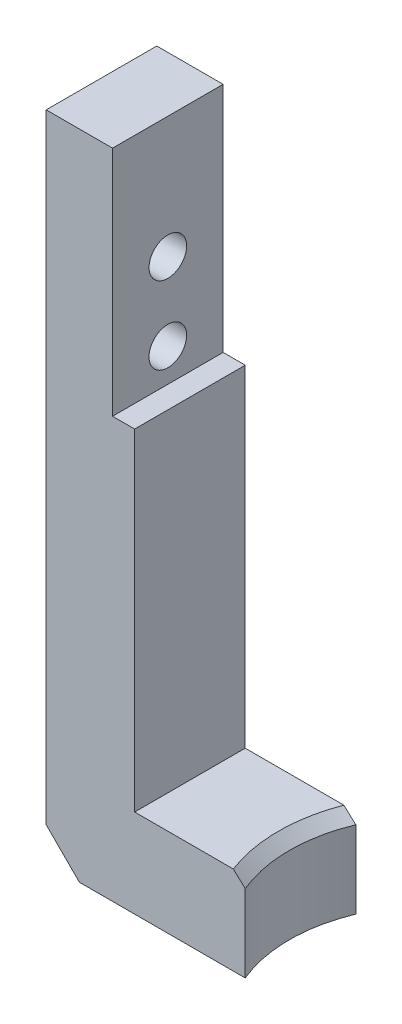
from build123d import *

# Parameters (mm, degrees)
BOSS_EXTRU_1_DEPTH                                = 5
ESQUISSE2_R                                       = 13
ENL_V_MAT_EXTRU_1_DEPTH                           = 10
CHANFREIN1_SIZE                                   = 3
CHANFREIN2_SIZE                                   = 1
CHAMBRAGE_POUR_VIS_SIX_PANS_CREUX_M31_D           = 3.4
CHAMBRAGE_POUR_VIS_SIX_PANS_CREUX_M31_CBORE_D     = 6.5
CHAMBRAGE_POUR_VIS_SIX_PANS_CREUX_M31_CBORE_DEPTH = 3.4


with BuildPart() as part:
    # Esquisse1 → Boss.-Extru.1 (new, symmetric)
    with BuildSketch(Plane.XY):
        Polygon((8, 0), (20, 0), (20, -8), (0, -8), (0, 0), (0, 30), (0, 51), (6, 51), (6, 30), (8, 30), align=None)
    extrude(amount=BOSS_EXTRU_1_DEPTH, both=True)

    # Esquisse2 → Enlèv. mat.-Extru.1 (cut)
    with BuildSketch(Plane.XZ.offset(8)):
        with Locations((30, 0)):
            Circle(ESQUISSE2_R)
    extrude(amount=-ENL_V_MAT_EXTRU_1_DEPTH, mode=Mode.SUBTRACT)

    # Chanfrein1
    chanfrein1_edges = [part.edges().sort_by_distance(p)[0] for p in [
        (0, -8, 0),
    ]]
    chamfer(chanfrein1_edges, length=CHANFREIN1_SIZE)

    # Chanfrein2
    chanfrein2_edges = [part.edges().sort_by_distance(p)[0] for p in [
        (17, 0, 0),
    ]]
    chamfer(chanfrein2_edges, length=CHANFREIN2_SIZE)

    # Chambrage pour vis à six pans creux M31 (through all)
    with Locations(Plane.ZY):
        with Locations((0, 40), (0, 33)):
            CounterBoreHole(CHAMBRAGE_POUR_VIS_SIX_PANS_CREUX_M31_D / 2, CHAMBRAGE_POUR_VIS_SIX_PANS_CREUX_M31_CBORE_D / 2, CHAMBRAGE_POUR_VIS_SIX_PANS_CREUX_M31_CBORE_DEPTH)


solid = part.part
